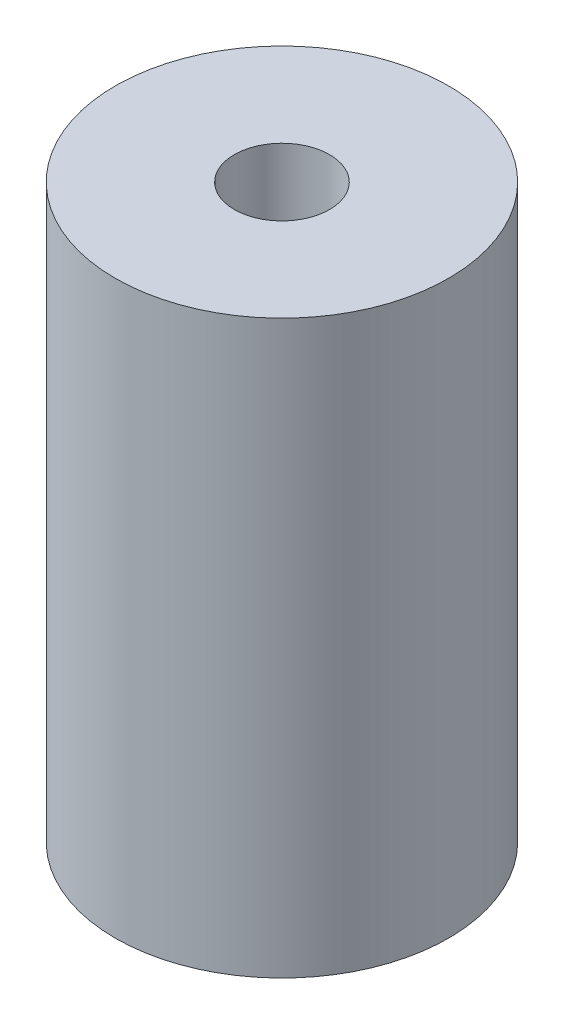
from build123d import *

# Parameters (mm, degrees)
SKETCH1_R           = 3.5
SKETCH1_R_2         = 1
BOSS_EXTRUDE1_DEPTH = 12


with BuildPart() as part:
    # Sketch1 → Boss-Extrude1 (new body)
    with BuildSketch(Plane(origin=(0, 0, 0), x_dir=(1, 0, 0), z_dir=(0, 1, 0))):
        with Locations(Location((0, 0, 0), (0, 0, 270))):
            Circle(SKETCH1_R)
        with Locations(Location((0, 0, 0), (0, 0, 270))):
            Circle(SKETCH1_R_2, mode=Mode.SUBTRACT)
    extrude(amount=BOSS_EXTRUDE1_DEPTH)


solid = part.part
